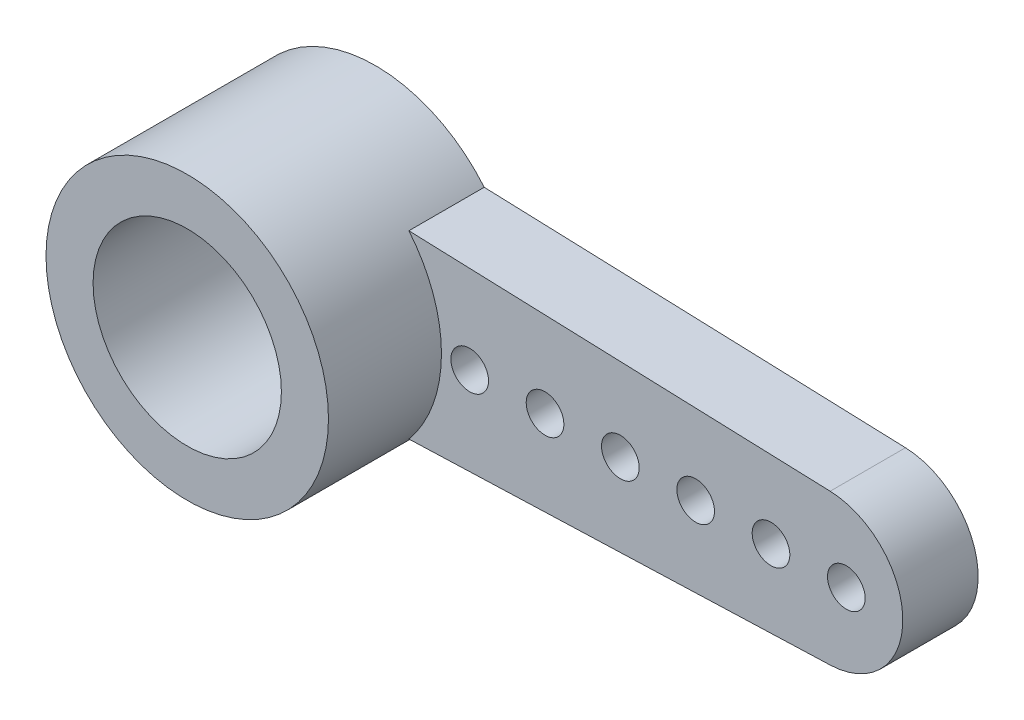
from build123d import *

# Parameters (mm, degrees)
EXTRUDE_3_DEPTH         = 2
EXTRUDE_3_2_DEPTH       = 2
SKETCH_2_R              = 3.75
SKETCH_2_R_2            = 2.5
EXTRUDE_5_DEPTH         = 3
EXTRUDE_START           = 2
SKETCH_3_R              = 3.75
SKETCH_3_R_2            = 2.5
EXTRUDE_6_DEPTH         = 2
SKETCH_4_R              = 0.5
CUT_EXTRUDE_1_DEPTH     = 2
SKETCH_5_R              = 2.5
EXTRUDE_7_DEPTH         = 1
SKETCH_6_R              = 2.5
CUT_EXTRUDE_2_DEPTH     = 0.5
SKETCH_7_R              = 1.25
CUT_EXTRUDE_3_DEPTH     = 5
CUT_EXTRUDE1_DEPTH      = 18.038559211
CUT_EXTRUDE1_DEPTH_BACK = 18.038559211


with BuildPart() as part:
    # Эскиз1 → Бобышка-Вытянуть3 (new body)
    with BuildSketch(Plane.XY):
        with BuildLine():
            ThreePointArc((-2.88547071, -2.395111434), (-3.527252129, -1.273182005), (-3.75, 0))
            ThreePointArc((-3.75, 0), (-3.527252129, 1.273182005), (-2.88547071, 2.395111434))
            Line((-2.88547071, 2.395111434), (-14.07082784, 1.998745461))
            ThreePointArc((-14.07082784, 1.998745461), (-16, 0), (-14.07082784, -1.998745461))
            Line((-14.07082784, -1.998745461), (-2.88547071, -2.395111434))
        make_face()
    extrude(amount=EXTRUDE_3_DEPTH)



with BuildPart() as body_2:
    # Эскиз1 → Extrude 3 2 (new body)
    with BuildSketch(Plane.XY):
        with BuildLine():
            Line((14.07082784, 1.998745461), (2.88547071, 2.395111434))
            ThreePointArc((2.88547071, 2.395111434), (3.75, 0), (2.88547071, -2.395111434))
            Line((2.88547071, -2.395111434), (14.07082784, -1.998745461))
            ThreePointArc((14.07082784, -1.998745461), (16, 0), (14.07082784, 1.998745461))
        make_face()
    extrude(amount=EXTRUDE_3_2_DEPTH)


with BuildPart() as body_3:
    # Эскиз2 → Бобышка-Вытянуть5 (new body)
    with BuildSketch(Plane.XY.offset(2)):
        Circle(SKETCH_2_R)
        Circle(SKETCH_2_R_2, mode=Mode.SUBTRACT)
    extrude(amount=EXTRUDE_5_DEPTH)


with BuildPart() as part_1:
    add(part.part)

    add(body_2.part)  # Бобышка-Вытянуть6 merges body 2

    add(body_3.part)  # Бобышка-Вытянуть6 merges body 3
    # Эскиз3 → Бобышка-Вытянуть6 (add)
    with BuildSketch(Plane(origin=(0, 0, 2), x_dir=(-1, 0, 0), z_dir=(0, 0, -1)).offset(EXTRUDE_START)):
        with Locations(Location((0, 0, 0), (0, 0, 180))):
            Circle(SKETCH_3_R)
        with Locations(Location((0, 0, 0), (0, 0, 180))):
            Circle(SKETCH_3_R_2, mode=Mode.SUBTRACT)
    extrude(amount=-EXTRUDE_6_DEPTH)

    # Эскиз4 → Вырез-Вытянуть1 (cut)
    with BuildSketch(Plane(origin=(0, 0, 0), x_dir=(-1, 0, 0), z_dir=(0, 0, -1))):
        with Locations((-14.5, 0)):
            Circle(SKETCH_4_R)
        with Locations((-4.5, 0)):
            Circle(SKETCH_4_R)
        with Locations((-6.5, 0)):
            Circle(SKETCH_4_R)
        with Locations((-8.5, 0)):
            Circle(SKETCH_4_R)
        with Locations((-10.5, 0)):
            Circle(SKETCH_4_R)
        with Locations((-12.5, 0)):
            Circle(SKETCH_4_R)
        with Locations((4.5, 0)):
            Circle(SKETCH_4_R)
        with Locations((6.5, 0)):
            Circle(SKETCH_4_R)
        with Locations((8.5, 0)):
            Circle(SKETCH_4_R)
        with Locations((10.5, 0)):
            Circle(SKETCH_4_R)
        with Locations((12.5, 0)):
            Circle(SKETCH_4_R)
        with Locations((14.5, 0)):
            Circle(SKETCH_4_R)
    extrude(amount=-CUT_EXTRUDE_1_DEPTH, mode=Mode.SUBTRACT)

    # Эскиз5 → Бобышка-Вытянуть7 (add)
    with BuildSketch(Plane(origin=(0, 0, 0), x_dir=(-1, 0, 0), z_dir=(0, 0, -1))):
        with Locations(Location((0, 0, 0), (0, 0, 180))):
            Circle(SKETCH_5_R)
    extrude(amount=-EXTRUDE_7_DEPTH)

    # Эскиз6 → Вырез-Вытянуть2 (cut)
    with BuildSketch(Plane(origin=(0, 0, 0), x_dir=(-1, 0, 0), z_dir=(0, 0, -1))):
        with Locations(Location((0, 0, 0), (0, 0, 180))):
            Circle(SKETCH_6_R)
    extrude(amount=-CUT_EXTRUDE_2_DEPTH, mode=Mode.SUBTRACT)

    # Эскиз7 → Вырез-Вытянуть3 (cut)
    with BuildSketch(Plane(origin=(0, 0, 0.5), x_dir=(-1, 0, 0), z_dir=(0, 0, -1))):
        Circle(SKETCH_7_R)
    extrude(amount=-CUT_EXTRUDE_3_DEPTH, mode=Mode.SUBTRACT)

    # Эскиз8 → Cut-Extrude1 (cut, two sides: drawn at the far end of the back side and taken through both)
    with BuildSketch(Plane(origin=(0, 0, 0.5), x_dir=(-1, 0, 0), z_dir=(0, 0, -1)).offset(-CUT_EXTRUDE1_DEPTH_BACK)):
        with BuildLine():
            Line((17.002746567, -3.75), (0, -3.75))
            ThreePointArc((0, -3.75), (3.75, 0), (0, 3.75))
            Line((0, 3.75), (17.002746567, 3.75))
            Line((17.002746567, 3.75), (17.002746567, -3.75))
        make_face()
    extrude(amount=CUT_EXTRUDE1_DEPTH + CUT_EXTRUDE1_DEPTH_BACK, mode=Mode.SUBTRACT)


solid = part_1.part
